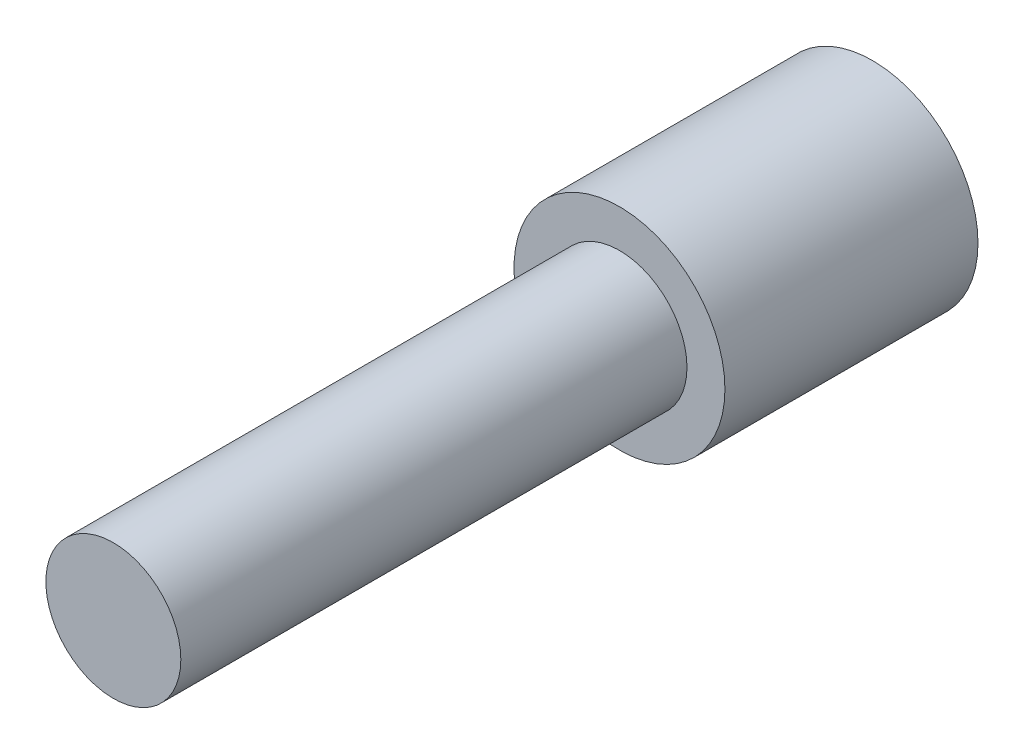
from build123d import *

# Parameters (mm, degrees)
SKETCH1_R           = 6.25
SKETCH1_R_2         = 4
BOSS_EXTRUDE1_DEPTH = 15
BOSS_EXTRUDE2_START = 15
SKETCH1_3_R         = 4
BOSS_EXTRUDE2_DEPTH = 30
SKETCH2_R           = 2
CUT_EXTRUDE1_DEPTH  = 12


with BuildPart() as part:
    # Sketch1 → Boss-Extrude1 (new body)
    # profile 1 of 2: a face of its own
    with BuildSketch(Plane.XY):
        Circle(SKETCH1_R)
        Circle(SKETCH1_R_2, mode=Mode.SUBTRACT)
    # profile 2 of 2: a face of its own
    with BuildSketch(Plane.XY):
        Circle(SKETCH1_R_2)
    extrude(amount=BOSS_EXTRUDE1_DEPTH)

    # Sketch1<3> → Boss-Extrude2 (add)
    with BuildSketch(Plane.XY.offset(BOSS_EXTRUDE2_START)):
        Circle(SKETCH1_3_R)
    extrude(amount=BOSS_EXTRUDE2_DEPTH)

    # Sketch2 → Cut-Extrude1 (cut)
    with BuildSketch(Plane(origin=(0, 0, 0), x_dir=(-1, 0, 0), z_dir=(0, 0, -1))):
        Circle(SKETCH2_R)
    extrude(amount=-CUT_EXTRUDE1_DEPTH, mode=Mode.SUBTRACT)


solid = part.part
